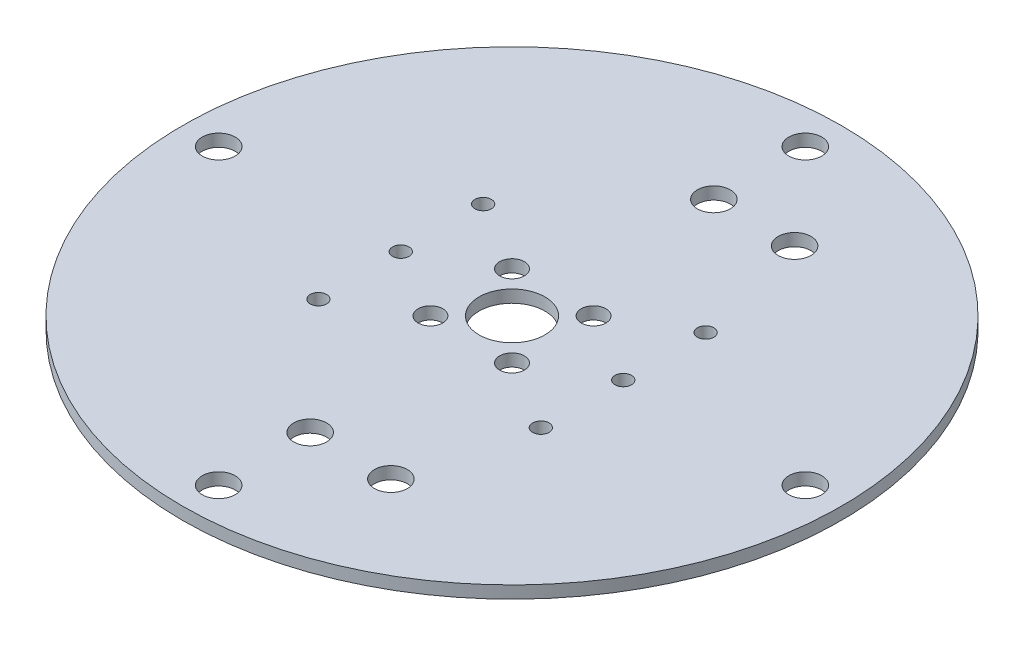
from build123d import *

# Parameters (mm, degrees)
SKETCH1_R           = 40
SKETCH1_R_2         = 2
SKETCH1_R_3         = 4
SKETCH1_R_4         = 1.5
SKETCH1_R_5         = 1
BOSS_EXTRUDE1_DEPTH = 1.5


with BuildPart() as part:
    # Sketch1 → Boss-Extrude1 (new body)
    with BuildSketch(Plane(origin=(0, 0, 0), x_dir=(1, 0, 0), z_dir=(0, 1, 0))):
        with Locations(Location((0, 0, 0), (0, 0, 270))):
            Circle(SKETCH1_R)
        with Locations(Location((0, 35.6, 0), (0, 0, 270))):
            Circle(SKETCH1_R_2, mode=Mode.SUBTRACT)
        with Locations(Location((-35.6, 0, 0), (0, 0, 270))):
            Circle(SKETCH1_R_2, mode=Mode.SUBTRACT)
        with Locations(Location((0, -35.6, 0), (0, 0, 270))):
            Circle(SKETCH1_R_2, mode=Mode.SUBTRACT)
        with Locations(Location((35.6, 0, 0), (0, 0, 270))):
            Circle(SKETCH1_R_2, mode=Mode.SUBTRACT)
        with Locations(Location((0, 0, 0), (0, 0, 270))):
            Circle(SKETCH1_R_3, mode=Mode.SUBTRACT)
        with Locations(Location((-4.949747468, 4.949747468, 0), (0, 0, 270))):
            Circle(SKETCH1_R_4, mode=Mode.SUBTRACT)
        with Locations(Location((4.949747468, 4.949747468, 0), (0, 0, 270))):
            Circle(SKETCH1_R_4, mode=Mode.SUBTRACT)
        with Locations(Location((4.949747468, -4.949747468, 0), (0, 0, 270))):
            Circle(SKETCH1_R_4, mode=Mode.SUBTRACT)
        with Locations(Location((-4.949747468, -4.949747468, 0), (0, 0, 270))):
            Circle(SKETCH1_R_4, mode=Mode.SUBTRACT)
        with Locations(Location((0, 24.5, 0), (0, 0, 270))):
            Circle(SKETCH1_R_2, mode=Mode.SUBTRACT)
        with Locations(Location((0, -24.5, 0), (0, 0, 270))):
            Circle(SKETCH1_R_2, mode=Mode.SUBTRACT)
        with Locations(Location((9.8, 24.5, 0), (0, 0, 270))):
            Circle(SKETCH1_R_2, mode=Mode.SUBTRACT)
        with Locations(Location((9.8, -24.5, 0), (0, 0, 90))):
            Circle(SKETCH1_R_2, mode=Mode.SUBTRACT)
        with Locations(Location((-13.5, 0, 0), (0, 0, 270))):
            Circle(SKETCH1_R_5, mode=Mode.SUBTRACT)
        with Locations(Location((-13.5, 10, 0), (0, 0, 270))):
            Circle(SKETCH1_R_5, mode=Mode.SUBTRACT)
        with Locations(Location((-13.5, -10, 0), (0, 0, 270))):
            Circle(SKETCH1_R_5, mode=Mode.SUBTRACT)
        with Locations(Location((13.5, 10, 0), (0, 0, 90))):
            Circle(SKETCH1_R_5, mode=Mode.SUBTRACT)
        with Locations(Location((13.5, 0, 0), (0, 0, 90))):
            Circle(SKETCH1_R_5, mode=Mode.SUBTRACT)
        with Locations(Location((13.5, -10, 0), (0, 0, 90))):
            Circle(SKETCH1_R_5, mode=Mode.SUBTRACT)
    extrude(amount=BOSS_EXTRUDE1_DEPTH)


solid = part.part
